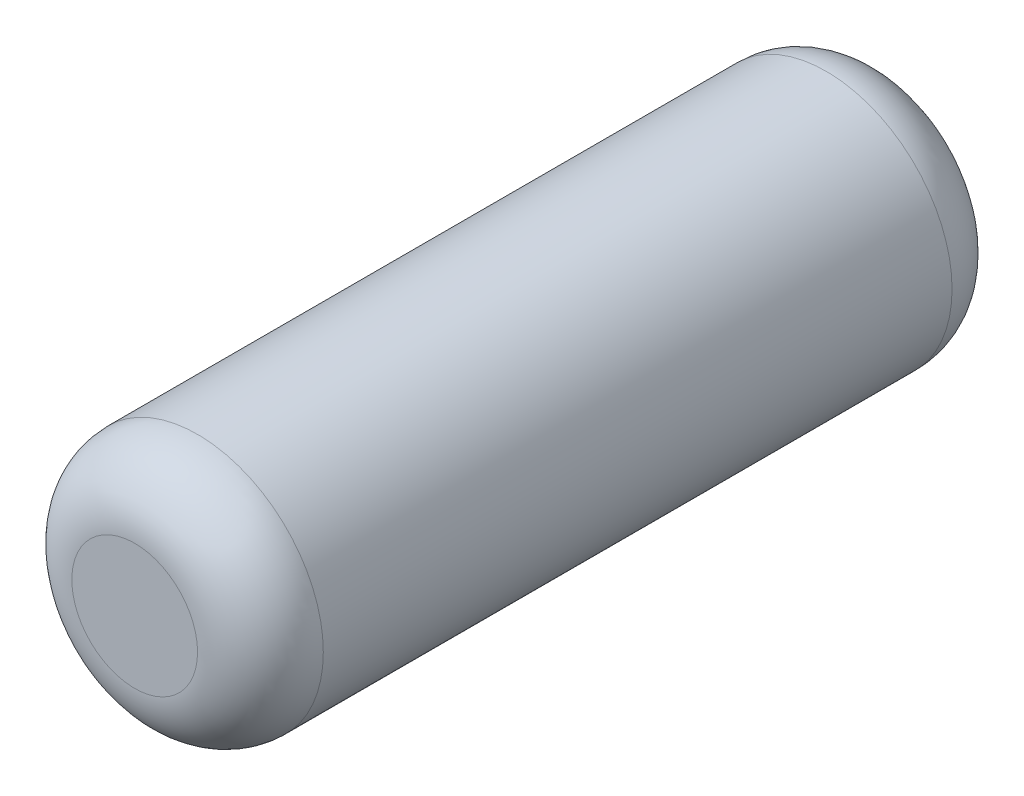
from build123d import *

# Parameters (mm, degrees)
SKETCH1_R           = 50
BOSS_EXTRUDE1_DEPTH = 150
FILLET1_R           = 25


with BuildPart() as part:
    # Sketch1 → Boss-Extrude1 (new, symmetric)
    with BuildSketch(Plane.XY):
        Circle(SKETCH1_R)
    extrude(amount=BOSS_EXTRUDE1_DEPTH, both=True)

    # Fillet1
    fillet1_edges = [part.edges().sort_by_distance(p)[0] for p in [
        (-50, 0, -150),
        (-50, 0, 150),
    ]]
    fillet(fillet1_edges, radius=FILLET1_R)


solid = part.part
